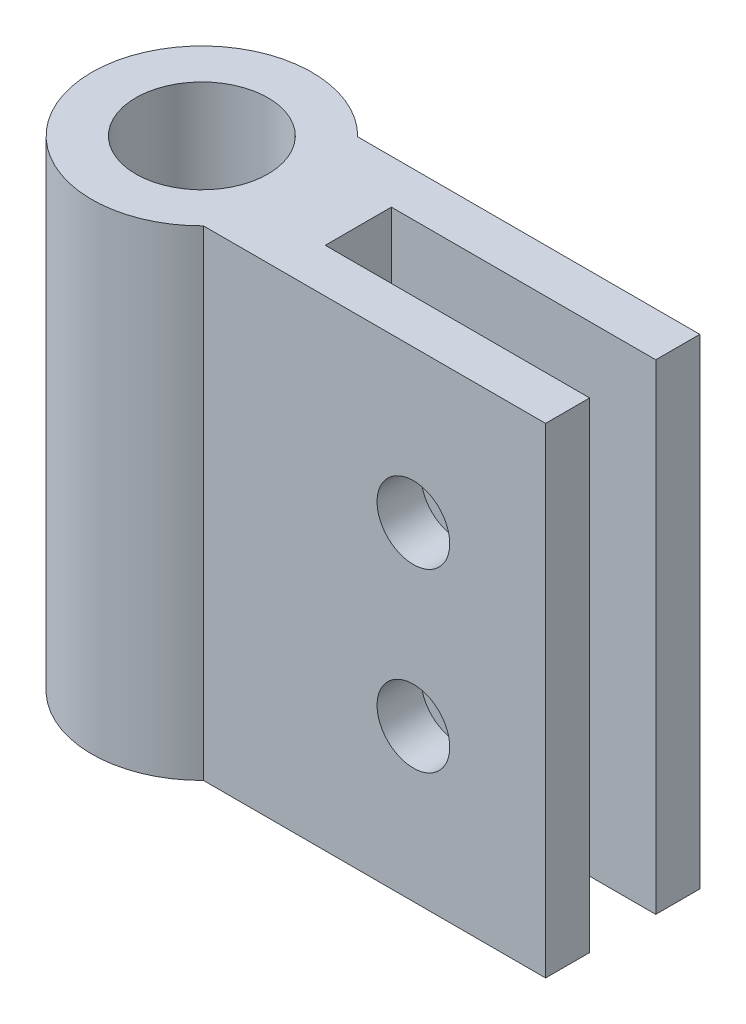
from build123d import *

# Parameters (mm, degrees)
SKETCH_1_R          = 5
SKETCH_1_R_2        = 3
EXTRUDE_1_DEPTH     = 21.8
SKETCH_2_W          = 16
SKETCH_2_H          = 7
EXTRUDE_2_DEPTH     = 21.8
SKETCH_3_W          = 12
SKETCH_3_H          = 3
CUT_EXTRUDE_1_DEPTH = 22
SKETCH_4_R          = 1.65
CUT_EXTRUDE_2_DEPTH = 22


with BuildPart() as part:
    # 草图1 → 凸台-拉伸1 (new body)
    with BuildSketch(Plane(origin=(0, 0, 0), x_dir=(1, 0, 0), z_dir=(0, 1, 0))):
        with Locations(Location((0, 0, 0), (0, 0, 270))):
            Circle(SKETCH_1_R)
        with Locations(Location((0, 0, 0), (0, 0, 270))):
            Circle(SKETCH_1_R_2, mode=Mode.SUBTRACT)
    extrude(amount=EXTRUDE_1_DEPTH)

    # 草图2 → 凸台-拉伸2 (add)
    with BuildSketch(Plane(origin=(0, 21.8, 0), x_dir=(1, 0, 0), z_dir=(0, 1, 0))):
        with Locations((11.1, 0)):
            Rectangle(SKETCH_2_W, SKETCH_2_H)
    extrude(amount=-EXTRUDE_2_DEPTH)

    # 草图3 → 切除-拉伸1 (cut)
    with BuildSketch(Plane(origin=(0, 21.8, 0), x_dir=(1, 0, 0), z_dir=(0, 1, 0))):
        with Locations((13.1, 0)):
            Rectangle(SKETCH_3_W, SKETCH_3_H)
    extrude(amount=-CUT_EXTRUDE_1_DEPTH, mode=Mode.SUBTRACT)

    # 草图4 → 切除-拉伸2 (cut)
    with BuildSketch(Plane.XY.offset(3.5)):
        with Locations(Location((13.1, 14.9, 0), (0, 0, 180))):
            Circle(SKETCH_4_R)
        with Locations(Location((13.1, 6.9, 0), (0, 0, 180))):
            Circle(SKETCH_4_R)
    extrude(amount=-CUT_EXTRUDE_2_DEPTH, mode=Mode.SUBTRACT)


solid = part.part
